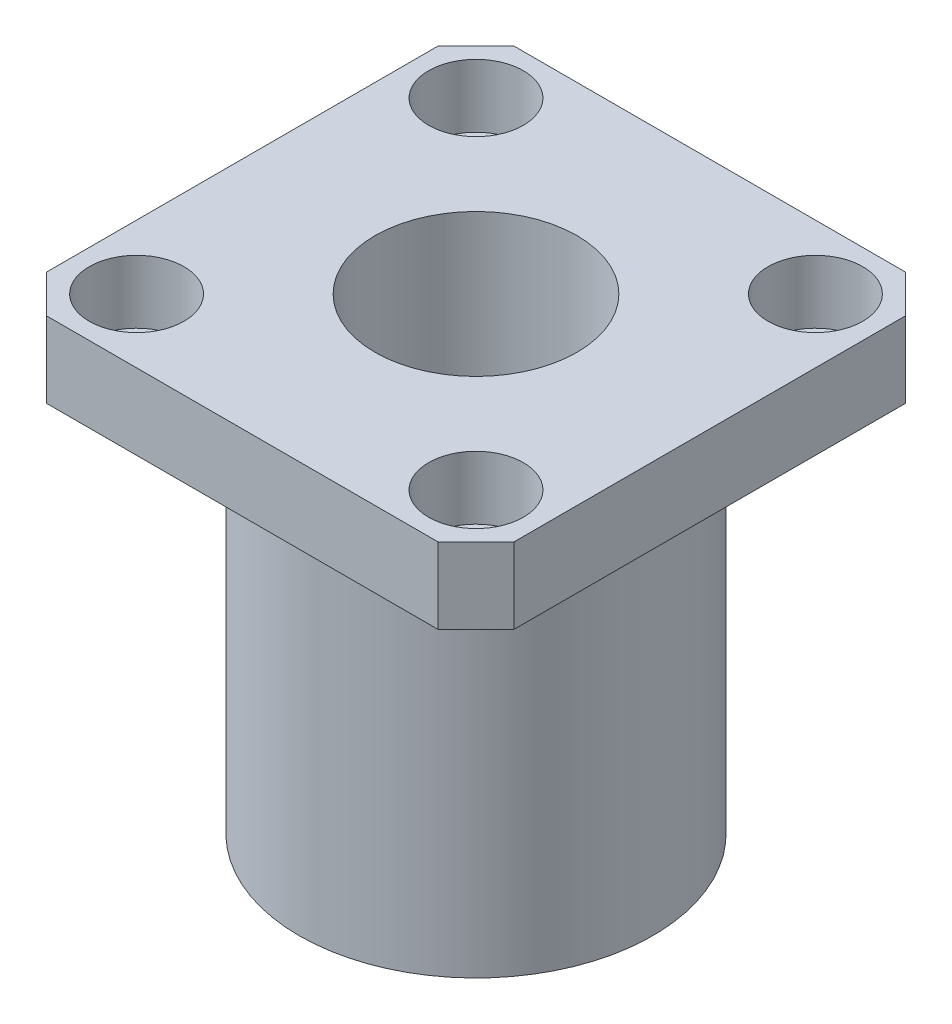
from build123d import *

# Parameters (mm, degrees)
SKETCH_1_R                   = 14
SKETCH_1_R_2                 = 8
EXTRUDE_1_DEPTH              = 37
EXTRUDE_START                = -6
SKETCH_2_W                   = 37
SKETCH_2_H                   = 37
SKETCH_2_R                   = 8
EXTRUDE_2_DEPTH              = 6
HOLE_WIZARD_M3_1_D           = 4.5
HOLE_WIZARD_M3_1_CBORE_D     = 7.5
HOLE_WIZARD_M3_1_CBORE_DEPTH = 5
CHAMFER_1_SIZE               = 3


with BuildPart() as part:
    # 草图1 → 凸台-拉伸1 (new body)
    with BuildSketch(Plane(origin=(0, 0, 0), x_dir=(1, 0, 0), z_dir=(0, 1, 0))):
        with Locations(Location((0, 0, 0), (0, 0, 270))):
            Circle(SKETCH_1_R)
        with Locations(Location((0, 0, 0), (0, 0, 270))):
            Circle(SKETCH_1_R_2, mode=Mode.SUBTRACT)
    extrude(amount=EXTRUDE_1_DEPTH)

    # 草图2 → 凸台-拉伸2 (add)
    with BuildSketch(Plane(origin=(0, 37, 0), x_dir=(1, 0, 0), z_dir=(0, 1, 0)).offset(EXTRUDE_START)):
        Rectangle(SKETCH_2_W, SKETCH_2_H)
        with Locations(Location((0, 0, 0), (0, 0, 270))):
            Circle(SKETCH_2_R, mode=Mode.SUBTRACT)
    extrude(amount=EXTRUDE_2_DEPTH)

    # M3 六角头螺栓的柱形沉头孔1 (through all)
    with Locations(Plane(origin=(0, 37, 0), x_dir=(-1, 0, 0), z_dir=(0, 1, 0))):
        with Locations((-13.435028843, 13.435028843), (13.435028843, 13.435028843), (13.435028843, -13.435028843), (-13.435028843, -13.435028843)):
            CounterBoreHole(HOLE_WIZARD_M3_1_D / 2, HOLE_WIZARD_M3_1_CBORE_D / 2, HOLE_WIZARD_M3_1_CBORE_DEPTH)

    # 倒角1
    chamfer_1_edges = [part.edges().sort_by_distance(p)[0] for p in [
        (-18.5, 34, 18.5),
        (-18.5, 34, -18.5),
        (18.5, 34, -18.5),
        (18.5, 34, 18.5),
    ]]
    chamfer(chamfer_1_edges, length=CHAMFER_1_SIZE)


solid = part.part
